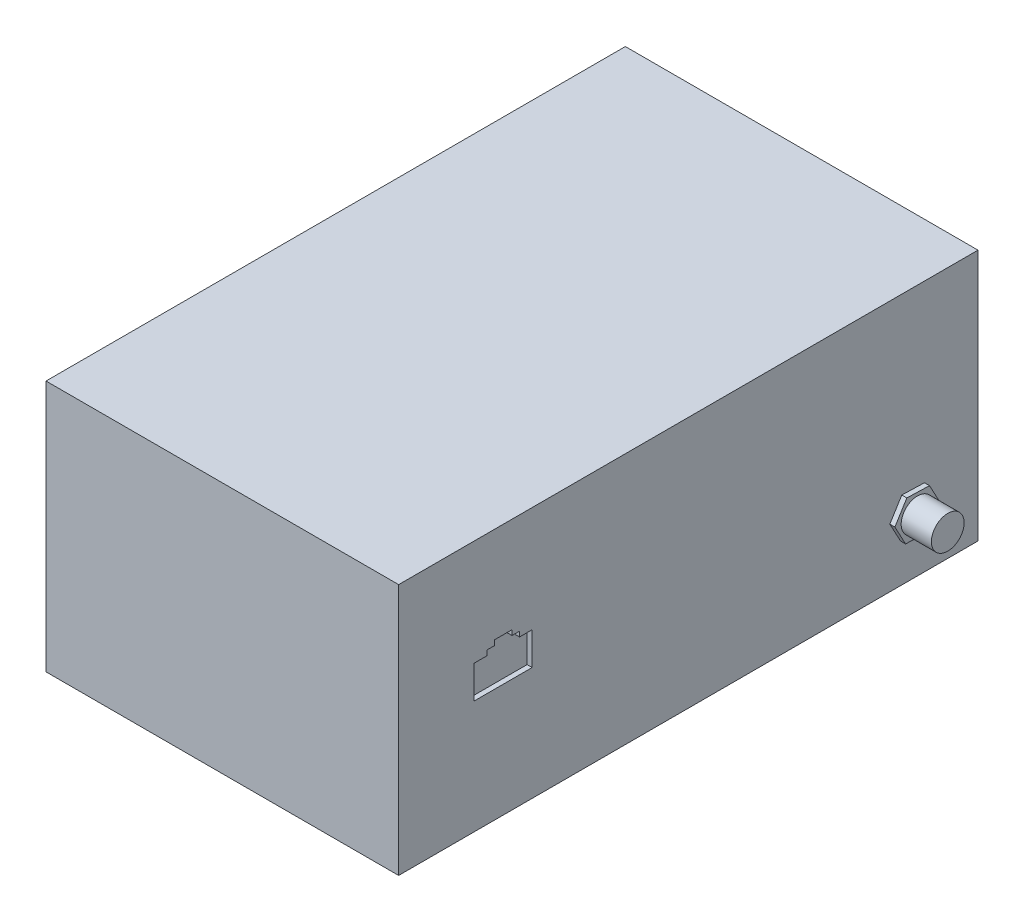
from build123d import *

# Parameters (mm, degrees)
SKETCH_1_W             = 70
SKETCH_1_H             = 50
EXTRUDE_1_DEPTH        = 115
CUT_EXTRUDE_1_DEPTH    = 1
EXTRUDE_2_DEPTH        = 1
SKETCH_4_R             = 3.25
EXTRUDE_3_DEPTH        = 6
EXTRUDE_4_DEPTH        = 1
SKETCH_6_R             = 3.25
EXTRUDE_5_DEPTH        = 6
CUT_EXTRUDE_2_DEPTH    = 1
HOLE_WIZARD_M3_1_D     = 2.5
HOLE_WIZARD_M3_1_DEPTH = 2
HOLE_WIZARD_M3_1_TIP   = 0.751075774
SKETCH_10_W            = 25
SKETCH_10_H            = 10
EXTRUDE_6_DEPTH        = 2


with BuildPart() as part:
    # 草图1 → 凸台-拉伸1 (new body)
    with BuildSketch(Plane.XY):
        Rectangle(SKETCH_1_W, SKETCH_1_H)
    extrude(amount=EXTRUDE_1_DEPTH)

    # 草图2 → 切除-拉伸1 (cut)
    with BuildSketch(Plane(origin=(35, 0, 0), x_dir=(0, 0, -1), z_dir=(1, 0, 0))):
        Polygon((-100, -2.5), (-88.5, -2.5), (-88.5, 4), (-91, 4), (-91, 5), (-92.5, 5), (-92.5, 6), (-96, 6), (-96, 5), (-97.5, 5), (-97.5, 4), (-100, 4), align=None)
    extrude(amount=-CUT_EXTRUDE_1_DEPTH, mode=Mode.SUBTRACT)

    # 草图3 → 凸台-拉伸2 (add)
    with BuildSketch(Plane(origin=(35, 0, 0), x_dir=(0, 0, -1), z_dir=(1, 0, 0))):
        Polygon((-15.124996356, -9.533340135), (-17.49772639, -13.356970895), (-15.372730033, -17.32363076), (-10.875003644, -17.466659865), (-8.50227361, -13.643029105), (-10.627269967, -9.67636924), align=None)
    extrude(amount=EXTRUDE_2_DEPTH)

    # 草图4 → 凸台-拉伸3 (add)
    with BuildSketch(Plane(origin=(36, 0, 0), x_dir=(0, 0, -1), z_dir=(1, 0, 0))):
        with Locations((-13, -13.5)):
            Circle(SKETCH_4_R)
    extrude(amount=EXTRUDE_3_DEPTH)

    # 草图5 → 凸台-拉伸4 (add)
    with BuildSketch(Plane(origin=(0, 0, 0), x_dir=(-1, 0, 0), z_dir=(0, 0, -1))):
        Polygon((24.897114317, -18.25), (24.897114317, -13.75), (21, -11.5), (17.102885683, -13.75), (17.102885683, -18.25), (21, -20.5), align=None)
    extrude(amount=EXTRUDE_4_DEPTH)

    # 草图6 → 凸台-拉伸5 (add)
    with BuildSketch(Plane(origin=(0, 0, -1), x_dir=(-1, 0, 0), z_dir=(0, 0, -1))):
        with Locations((21, -16)):
            Circle(SKETCH_6_R)
    extrude(amount=EXTRUDE_5_DEPTH)

    # 草图7 → 切除-拉伸2 (cut)
    with BuildSketch(Plane(origin=(0, 0, 0), x_dir=(-1, 0, 0), z_dir=(0, 0, -1))):
        Polygon((-24, 4), (-21.25, 4), (-21.25, 5), (-20.25, 5), (-20.25, 6), (-16.25, 6), (-16.25, 5), (-15.25, 5), (-15.25, 4), (-12.5, 4), (-12.5, -2.5), (-24, -2.5), align=None)
    extrude(amount=-CUT_EXTRUDE_2_DEPTH, mode=Mode.SUBTRACT)

    # M3 螺纹孔的螺纹孔钻头1
    with Locations(Plane.ZY.offset(35)):
        with Locations((55, -9), (55, 9)):
            Hole(HOLE_WIZARD_M3_1_D / 2, depth=HOLE_WIZARD_M3_1_DEPTH)
            with Locations((0, 0, -(HOLE_WIZARD_M3_1_DEPTH + HOLE_WIZARD_M3_1_TIP / 2))):  # 118° drill point
                Cone(0, HOLE_WIZARD_M3_1_D / 2, HOLE_WIZARD_M3_1_TIP, mode=Mode.SUBTRACT)

    # 草图10 → 凸台-拉伸6 (add)
    with BuildSketch(Plane(origin=(0, 0, 0), x_dir=(-1, 0, 0), z_dir=(0, 0, -1))):
        with Locations((6.785143616, 0)):
            Rectangle(SKETCH_10_W, SKETCH_10_H)
    extrude(amount=EXTRUDE_6_DEPTH)


solid = part.part
